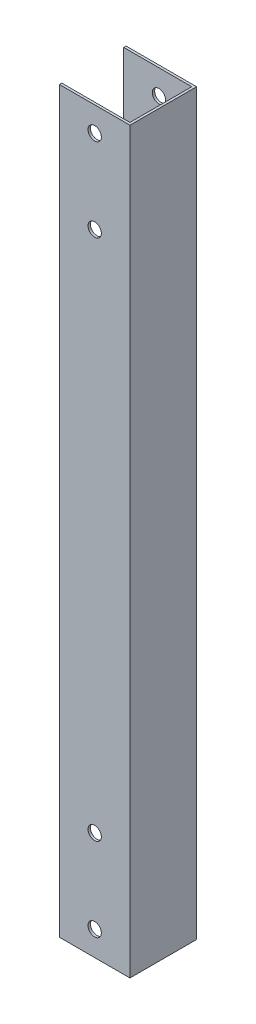
from build123d import *

# Parameters (mm, degrees)
BOSS_EXTRUDE1_DEPTH      = 133
BOSS_EXTRUDE1_DEPTH_BACK = 133
SKETCH1_W                = 25.4
SKETCH1_H                = 24
CUT_EXTRUDE1_DEPTH       = 150
CUT_EXTRUDE1_DEPTH_BACK  = 150
SKETCH2_W                = 26
SKETCH2_H                = 22.28
CUT_EXTRUDE2_DEPTH       = 150
CUT_EXTRUDE2_DEPTH_BACK  = 150
SKETCH3_R                = 2.4


with BuildPart() as part:
    # Sketch1 → Boss-Extrude1 (new, two sides: drawn at the far end of the back side and taken through both)
    with BuildSketch(Plane(origin=(0, 0, 0), x_dir=(1, 0, 0), z_dir=(0, 1, 0)).offset(-BOSS_EXTRUDE1_DEPTH_BACK)):
        Rectangle(SKETCH1_W, SKETCH1_H)
    extrude(amount=BOSS_EXTRUDE1_DEPTH + BOSS_EXTRUDE1_DEPTH_BACK)

    # Sketch2 → Cut-Extrude1 (cut, two sides: drawn at the far end of the back side and taken through both)
    with BuildSketch(Plane(origin=(0, 0, 0), x_dir=(1, 0, 0), z_dir=(0, 1, 0)).offset(-CUT_EXTRUDE1_DEPTH_BACK)):
        with Locations((-1.16, 0)):
            Rectangle(SKETCH2_W, SKETCH2_H)
    extrude(amount=CUT_EXTRUDE1_DEPTH + CUT_EXTRUDE1_DEPTH_BACK, mode=Mode.SUBTRACT)

    # Sketch3 → Cut-Extrude2 (cut, two sides: drawn at the far end of the back side and taken through both)
    with BuildSketch(Plane.XY.offset(-CUT_EXTRUDE2_DEPTH_BACK)):
        with Locations((0, 124.125)):
            Circle(SKETCH3_R)
        with Locations((0, 94.125)):
            Circle(SKETCH3_R)
        with Locations((0, -124.125)):
            Circle(SKETCH3_R)
        with Locations((0, -94.125)):
            Circle(SKETCH3_R)
    extrude(amount=CUT_EXTRUDE2_DEPTH + CUT_EXTRUDE2_DEPTH_BACK, mode=Mode.SUBTRACT)


solid = part.part
